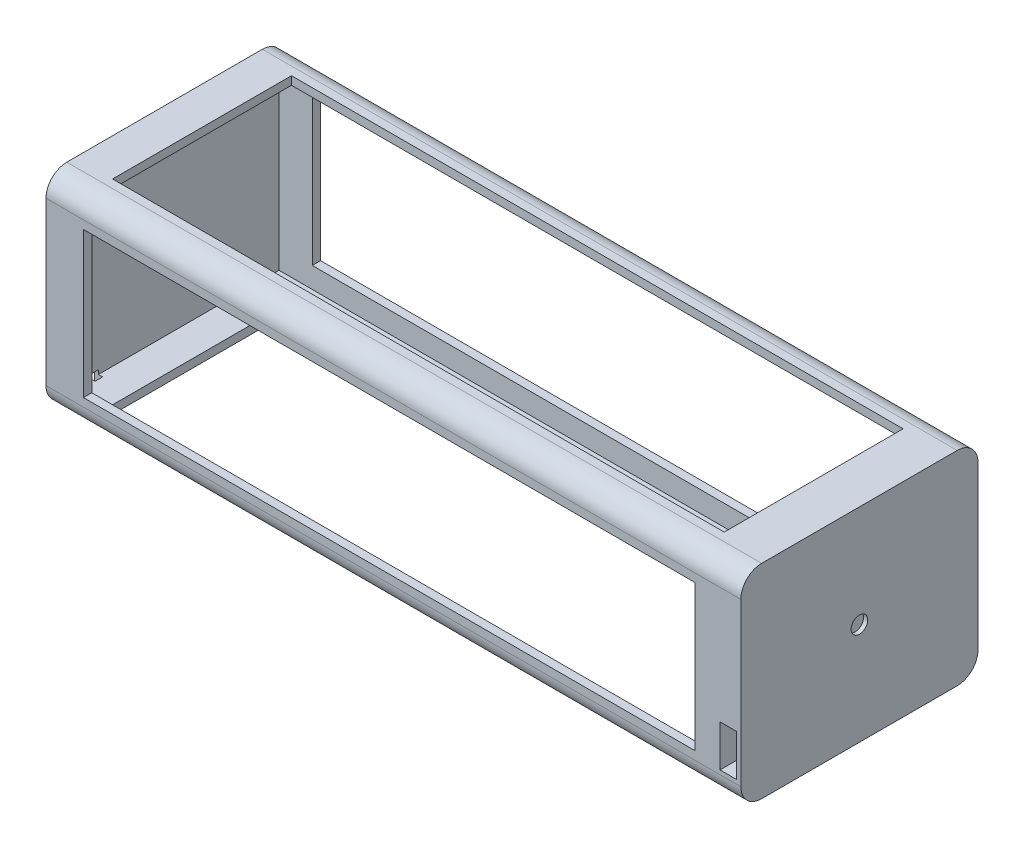
from build123d import *

# Parameters (mm, degrees)
SKETCH_1_W          = 57
SKETCH_1_H          = 49
SKETCH_1_W_2        = 53
SKETCH_1_H_2        = 45
EXTRUDE_1_DEPTH     = 5
EXTRUDE_2_DEPTH     = 147
SKETCH_3_W          = 57
SKETCH_3_H          = 49
SKETCH_3_W_2        = 53
SKETCH_3_H_2        = 45
EXTRUDE_3_DEPTH     = 8
SKETCH_5_W          = 57
SKETCH_5_H          = 49
EXTRUDE_4_DEPTH     = 1
SKETCH_7_W          = 57
SKETCH_7_H          = 49
EXTRUDE_6_DEPTH     = 1
SKETCH_8_W          = 1.8
SKETCH_8_H          = 3
SKETCH_8_W_2        = 0.5
SKETCH_8_H_2        = 1.5
CUT_EXTRUDE_1_DEPTH = 2
SKETCH_9_W          = 2.6
SKETCH_9_H          = 10
EXTRUDE_7_DEPTH     = 4
SKETCH_10_W         = 57
SKETCH_10_H         = 49
EXTRUDE_8_DEPTH     = 1
SKETCH_11_R         = 2
CUT_EXTRUDE_2_DEPTH = 6
FILLET_2_R          = 5


with BuildPart() as part:
    # Эскиз1 → Бобышка-Вытянуть1 (new body)
    with BuildSketch(Plane(origin=(0, 0, 0), x_dir=(0, 0, -1), z_dir=(1, 0, 0))):
        Rectangle(SKETCH_1_W, SKETCH_1_H)
        Rectangle(SKETCH_1_W_2, SKETCH_1_H_2, mode=Mode.SUBTRACT)
    extrude(amount=-EXTRUDE_1_DEPTH)

    # Эскиз2 → Бобышка-Вытянуть2 (add)
    with BuildSketch(Plane(origin=(-5, 0, 0), x_dir=(0, 0, -1), z_dir=(1, 0, 0))):
        Polygon((-28.5, 24.5), (-21.5, 24.5), (-21.5, 22.5), (-26.5, 22.5), (-26.5, 17.5), (-28.5, 17.5), align=None)
        Polygon((-28.5, -24.5), (-28.5, -17.5), (-26.5, -17.5), (-26.5, -22.5), (-21.5, -22.5), (-21.5, -24.5), align=None)
        Polygon((28.5, 24.5), (21.5, 24.5), (21.5, 22.5), (26.5, 22.5), (26.5, 17.5), (28.5, 17.5), align=None)
        Polygon((26.5, -22.5), (21.5, -22.5), (21.5, -24.5), (28.5, -24.5), (28.5, -17.5), (26.5, -17.5), align=None)
    extrude(amount=-EXTRUDE_2_DEPTH)

    # Эскиз3 → Бобышка-Вытянуть3 (add)
    with BuildSketch(Plane(origin=(-152, 0, 0), x_dir=(0, 0, -1), z_dir=(1, 0, 0))):
        Rectangle(SKETCH_3_W, SKETCH_3_H)
        Rectangle(SKETCH_3_W_2, SKETCH_3_H_2, mode=Mode.SUBTRACT)
    extrude(amount=-EXTRUDE_3_DEPTH)

    # Эскиз5 → Бобышка-Вытянуть4 (add)
    with BuildSketch(Plane(origin=(0, 0, 0), x_dir=(0, 0, -1), z_dir=(1, 0, 0))):
        Rectangle(SKETCH_5_W, SKETCH_5_H)
    extrude(amount=EXTRUDE_4_DEPTH)

    # Эскиз7 → Бобышка-Вытянуть6 (add)
    with BuildSketch(Plane.ZY.offset(160)):
        Rectangle(SKETCH_7_W, SKETCH_7_H)
    extrude(amount=EXTRUDE_6_DEPTH)

    # Эскиз8 → Вырез-Вытянуть1 (cut)
    with BuildSketch(Plane.ZY.offset(161)):
        with Locations((21.6, -23)):
            Rectangle(SKETCH_8_W, SKETCH_8_H)
        with Locations((17.8, -23)):
            Rectangle(SKETCH_8_W, SKETCH_8_H)
        with Locations((14.65, -23.75)):
            Rectangle(SKETCH_8_W_2, SKETCH_8_H_2)
        with Locations((13.15, -23.75)):
            Rectangle(SKETCH_8_W_2, SKETCH_8_H_2)
        with Locations((11.65, -23.75)):
            Rectangle(SKETCH_8_W_2, SKETCH_8_H_2)
        with Locations((10.15, -23.75)):
            Rectangle(SKETCH_8_W_2, SKETCH_8_H_2)
        with Locations((8.65, -23.75)):
            Rectangle(SKETCH_8_W_2, SKETCH_8_H_2)
        with Locations((7.15, -23.75)):
            Rectangle(SKETCH_8_W_2, SKETCH_8_H_2)
        with Locations((5.65, -23.75)):
            Rectangle(SKETCH_8_W_2, SKETCH_8_H_2)
    extrude(amount=-CUT_EXTRUDE_1_DEPTH, mode=Mode.SUBTRACT)

    # Эскиз9 → Бобышка-Вытянуть7 (add)
    with BuildSketch(Plane(origin=(1, 0, 0), x_dir=(0, 0, -1), z_dir=(1, 0, 0))):
        Polygon((24.5, -20.5), (-24.5, -20.5), (-24.5, -18.5), (-28.5, -18.5), (-28.5, -24.5), (28.5, -24.5), (28.5, 8.5), (24.5, 8.5), align=None)
        Polygon((24.5, 20.5), (-24.5, 20.5), (-24.5, -8.5), (-28.5, -8.5), (-28.5, 24.5), (28.5, 24.5), (28.5, 18.5), (24.5, 18.5), align=None)
        with Locations((0, -13.5)):
            Rectangle(SKETCH_9_W, SKETCH_9_H)
        with Locations((0, 13.5)):
            Rectangle(SKETCH_9_W, SKETCH_9_H)
    extrude(amount=EXTRUDE_7_DEPTH)

    # Эскиз10 → Бобышка-Вытянуть8 (add)
    with BuildSketch(Plane(origin=(5, 0, 0), x_dir=(0, 0, -1), z_dir=(1, 0, 0))):
        Rectangle(SKETCH_10_W, SKETCH_10_H)
    extrude(amount=EXTRUDE_8_DEPTH)

    # Эскиз11 → Вырез-Вытянуть2 (cut)
    with BuildSketch(Plane(origin=(6, 0, 0), x_dir=(0, 0, -1), z_dir=(1, 0, 0))):
        Circle(SKETCH_11_R)
    extrude(amount=-CUT_EXTRUDE_2_DEPTH, mode=Mode.SUBTRACT)

    # Скругление2
    fillet_2_edges = [part.edges().sort_by_distance(p)[0] for p in [
        (-77.5, 24.5, 28.5),
        (-77.5, 24.5, -28.5),
        (-77.5, -24.5, -28.5),
        (-77.5, -24.5, 28.5),
    ]]
    fillet(fillet_2_edges, radius=FILLET_2_R)


solid = part.part
